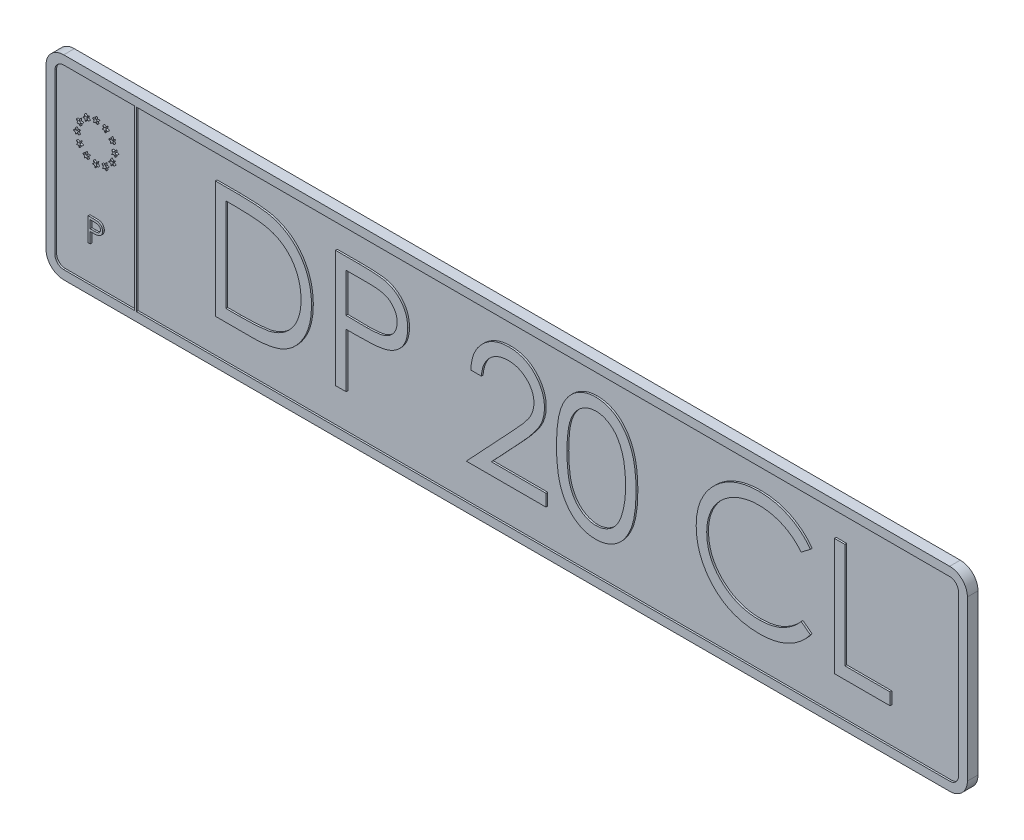
from build123d import *

# Parameters (mm, degrees)
BOSS_EXTRUDE1_DEPTH  = 5
BOSS_EXTRUDE2_DEPTH  = 1
SKETCH3_W            = 1
SKETCH3_H            = 100
BOSS_EXTRUDE4_DEPTH  = 1
BOSS_EXTRUDE9_DEPTH  = 1
BOSS_EXTRUDE8_DEPTH  = 1
BOSS_EXTRUDE10_DEPTH = 1


with BuildPart() as part:
    # Sketch1 → Boss-Extrude1 (new body)
    with BuildSketch(Plane.XY):
        with BuildLine():
            Line((10, 0), (510, 0))
            ThreePointArc((510, 0), (517.071067812, -2.928932188), (520, -10))
            Line((520, -10), (520, -100))
            ThreePointArc((520, -100), (517.071067812, -107.071067812), (510, -110))
            Line((510, -110), (10, -110))
            ThreePointArc((10, -110), (2.928932188, -107.071067812), (0, -100))
            Line((0, -100), (0, -10))
            ThreePointArc((0, -10), (2.928932188, -2.928932188), (10, 0))
        make_face()
    extrude(amount=BOSS_EXTRUDE1_DEPTH)

    # Sketch2 → Boss-Extrude2 (add)
    with BuildSketch(Plane.XY.offset(5)):
        with BuildLine():
            Line((510, 0), (10, 0))
            ThreePointArc((10, 0), (2.928932188, -2.928932188), (0, -10))
            Line((0, -10), (0, -100))
            ThreePointArc((0, -100), (2.928932188, -107.071067812), (10, -110))
            Line((10, -110), (510, -110))
            ThreePointArc((510, -110), (517.071067812, -107.071067812), (520, -100))
            Line((520, -100), (520, -10))
            ThreePointArc((520, -10), (517.071067812, -2.928932188), (510, 0))
        make_face()
        with BuildLine():
            Line((510, -5), (10, -5))
            ThreePointArc((10, -5), (6.464466094, -6.464466094), (5, -10))
            Line((5, -10), (5, -100))
            ThreePointArc((5, -100), (6.464466094, -103.535533906), (10, -105))
            Line((10, -105), (510, -105))
            ThreePointArc((510, -105), (513.535533906, -103.535533906), (515, -100))
            Line((515, -100), (515, -10))
            ThreePointArc((515, -10), (513.535533906, -6.464466094), (510, -5))
        make_face(mode=Mode.SUBTRACT)
    extrude(amount=BOSS_EXTRUDE2_DEPTH)

    # Sketch3 → Boss-Extrude4 (add)
    with BuildSketch(Plane.XY.offset(5)):
        with Locations((50.5, -55)):
            Rectangle(SKETCH3_W, SKETCH3_H)
    extrude(amount=BOSS_EXTRUDE4_DEPTH)

    # Sketch10 → Boss-Extrude9 (add)
    with BuildSketch(Plane.XY.offset(5)):
        with BuildLine():
            Line((23.768696581, -71.770833333), (26.36311849, -71.770833333))
            add(Edge.make_bspline(
                [(26.36311849, -71.770833333), (26.541564474, -71.771029489), (26.883474905, -71.771405331), (27.373766931, -71.782800353), (27.819059667, -71.79802029), (28.218392952, -71.819118517), (28.572995466, -71.844052058), (28.881262639, -71.879022564), (29.14561751, -71.915536181), (29.304013911, -71.952658759), (29.376252003, -71.969588842)],
                knots=[0, 0, 0, 0, 1.415646017, 2.712440637, 3.8905458, 4.950247383, 5.884950622, 6.709939814, 7.411656543, 8, 8, 8, 8], degree=3))
            add(Edge.make_bspline(
                [(29.376252003, -71.969588842), (29.467697801, -71.994618236), (29.648434589, -72.044087237), (29.908864127, -72.14316887), (30.156642055, -72.260652054), (30.392618481, -72.394546113), (30.613893617, -72.550595715), (30.823768831, -72.722475163), (31.020391971, -72.914152818), (31.202657351, -73.123478829), (31.370043342, -73.346939146), (31.514164464, -73.587869598), (31.634841781, -73.842214704), (31.738344027, -74.109797547), (31.812837292, -74.392865139), (31.868955038, -74.689450629), (31.904574107, -74.999522226), (31.907985576, -75.211415178), (31.909722222, -75.319281684)],
                knots=[0, 0, 0, 0, 0.999701418, 1.975846123, 2.934577507, 3.890451536, 4.834027766, 5.787354733, 6.749476667, 7.726910423, 8.712836071, 9.690891519, 10.682875813, 11.679750201, 12.712814741, 13.765529915, 14.8625177, 16, 16, 16, 16], degree=3))
            add(Edge.make_bspline(
                [(31.909722222, -75.319281684), (31.908129337, -75.428054828), (31.90501275, -75.640876832), (31.867607147, -75.952226359), (31.817222197, -76.249763131), (31.739748219, -76.532827423), (31.638277967, -76.799738222), (31.519245505, -77.054574426), (31.375676804, -77.293000567), (31.21070974, -77.515882232), (31.027196273, -77.723428627), (30.825912846, -77.914135737), (30.607672067, -78.086887254), (30.37316752, -78.242070458), (30.120113032, -78.376086752), (29.852346558, -78.496121804), (29.567540681, -78.596932063), (29.370454393, -78.649962354), (29.270249065, -78.676924746)],
                knots=[0, 0, 0, 0, 1.121902311, 2.195077645, 3.232258892, 4.234102512, 5.217864754, 6.176164875, 7.132989551, 8.084763148, 9.034132444, 9.988522005, 10.94243251, 11.903244335, 12.886203696, 13.894208494, 14.929344452, 16, 16, 16, 16], degree=3))
            add(Edge.make_bspline(
                [(29.270249065, -78.676924746), (29.187368963, -78.694549705), (29.005732402, -78.733175825), (28.706591755, -78.776297076), (28.358304136, -78.813102888), (27.961344923, -78.84069945), (27.516070431, -78.864324354), (27.022239786, -78.883102566), (26.478883602, -78.893420764), (26.099882173, -78.893952927), (25.902005709, -78.894230769)],
                knots=[0, 0, 0, 0, 0.601384939, 1.31797006, 2.144135048, 3.087295005, 4.142315834, 5.309527816, 6.595305764, 8, 8, 8, 8], degree=3))
            Line((25.902005709, -78.894230769), (24.955929487, -78.894230769))
            Line((24.955929487, -78.894230769), (24.955929487, -85))
            Line((24.955929487, -85), (23.768696581, -85))
            Line((23.768696581, -85), (23.768696581, -71.770833333))
        make_face()
        with BuildLine():
            Line((24.955929487, -73.12767094), (24.955929487, -77.537393162))
            Line((24.955929487, -77.537393162), (27.272093683, -77.56654397))
            add(Edge.make_bspline(
                [(27.272093683, -77.56654397), (27.385183879, -77.566602419), (27.60350217, -77.566715253), (27.918871228, -77.551652057), (28.211459904, -77.534263139), (28.480369459, -77.508802952), (28.725721117, -77.472814866), (28.947923979, -77.436484785), (29.145255078, -77.383925825), (29.376195513, -77.313157082), (29.633534356, -77.192459398), (29.913492054, -77.017267849), (30.150749925, -76.793956839), (30.356060154, -76.542875452), (30.51899011, -76.263554338), (30.638264247, -75.964692583), (30.708345407, -75.649355176), (30.717742628, -75.433575603), (30.722489316, -75.324581831)],
                knots=[0, 0, 0, 0, 1.160613943, 2.240541288, 3.23993089, 4.169200891, 5.011653406, 5.7853311, 6.478053781, 7.106038997, 8.262395093, 9.384106736, 10.481365981, 11.59014053, 12.70357646, 13.786202915, 14.881775077, 16, 16, 16, 16], degree=3))
            add(Edge.make_bspline(
                [(30.722489316, -75.324581831), (30.717716813, -75.21822495), (30.708229668, -75.006800633), (30.637714947, -74.696940437), (30.519222004, -74.401228102), (30.354966424, -74.125407214), (30.15561751, -73.875229294), (29.923920588, -73.657903844), (29.660421059, -73.483196812), (29.415310186, -73.370434111), (29.197591417, -73.301584707), (29.008482521, -73.253412244), (28.794961222, -73.214950875), (28.556958007, -73.183807517), (28.296317594, -73.157147113), (28.010800749, -73.139057258), (27.701489061, -73.128468421), (27.48675863, -73.127943203), (27.375446548, -73.12767094)],
                knots=[0, 0, 0, 0, 1.120700087, 2.227813068, 3.331159281, 4.466773991, 5.599788987, 6.693661531, 7.80175334, 8.91857717, 9.525282508, 10.207424825, 10.974604443, 11.810962634, 12.737642355, 13.736264703, 14.826523623, 16, 16, 16, 16], degree=3))
            Line((27.375446548, -73.12767094), (24.955929487, -73.12767094))
        make_face(mode=Mode.SUBTRACT)
    extrude(amount=BOSS_EXTRUDE9_DEPTH)

    # Sketch9 → Boss-Extrude8 (add)
    # profile 1 of 6: a face of its own
    with BuildSketch(Plane.XY.offset(5)):
        with BuildLine():
            Line((95.586805556, -85), (95.586805556, -18.854166667))
            Line((95.586805556, -18.854166667), (108.943175748, -18.854166667))
            add(Edge.make_bspline(
                [(108.943175748, -18.854166667), (110.104866448, -18.862530713), (112.349246834, -18.878690006), (115.59251779, -18.981147845), (118.593341872, -19.162396232), (121.341849775, -19.426403646), (123.845586966, -19.750575561), (126.097542803, -20.156907607), (128.109361575, -20.636713803), (129.346656063, -21.045787045), (129.931757479, -21.239232772)],
                knots=[0, 0, 0, 0, 1.314313732, 2.53924729, 3.670748893, 4.714932338, 5.66265055, 6.526160246, 7.303039223, 8, 8, 8, 8], degree=3))
            add(Edge.make_bspline(
                [(129.931757479, -21.239232772), (130.697059844, -21.530854739), (132.210310055, -22.107485654), (134.364908949, -23.19523123), (136.39323054, -24.427681218), (138.306151879, -25.806460171), (140.059977021, -27.370607828), (141.723221498, -29.053680726), (143.227844999, -30.916882989), (144.605724998, -32.921573982), (145.848050705, -35.044138065), (146.927912766, -37.280530744), (147.824736747, -39.619394646), (148.569221833, -42.054225568), (149.15596292, -44.590377351), (149.556276213, -47.230803093), (149.820311289, -49.965067536), (149.846846188, -51.820448026), (149.860309829, -52.76185647)],
                knots=[0, 0, 0, 0, 0.984719456, 1.947108742, 2.898477687, 3.838006223, 4.779231079, 5.722358779, 6.681677486, 7.655904652, 8.64651281, 9.637519902, 10.640069247, 11.656948941, 12.698408672, 13.768548281, 14.867775369, 16, 16, 16, 16], degree=3))
            add(Edge.make_bspline(
                [(149.860309829, -52.76185647), (149.848423092, -53.579442376), (149.824999037, -55.190580798), (149.614668216, -57.565044153), (149.308955024, -59.869065516), (148.8356495, -62.09167324), (148.261078189, -64.252340453), (147.524702116, -66.328039119), (146.681144376, -68.337810515), (145.697463635, -70.254480075), (144.617559484, -72.070341427), (143.458651539, -73.78211108), (142.221975897, -75.36536304), (140.895739978, -76.824891869), (139.497082241, -78.158497294), (138.016845637, -79.377319608), (136.4512106, -80.457510451), (134.8071895, -81.441516812), (133.036822177, -82.299907459), (131.106575897, -83.026188894), (129.008218813, -83.628052012), (126.746901472, -84.130210311), (124.318716699, -84.528546239), (121.721283863, -84.795518239), (118.958593716, -84.976057294), (117.061545102, -84.991864133), (116.085123698, -85)],
                knots=[0, 0, 0, 0, 1.105936401, 2.179363191, 3.223086493, 4.248585256, 5.251745608, 6.245858792, 7.225916811, 8.198733463, 9.158002045, 10.082870192, 10.993790845, 11.873723703, 12.748670949, 13.606408763, 14.465103618, 15.319838547, 16.196477973, 17.123216899, 18.106603292, 19.147568657, 20.255746949, 21.433717677, 22.679120308, 24, 24, 24, 24], degree=3))
            Line((116.085123698, -85), (95.586805556, -85))
        make_face()
        with BuildLine():
            Line((101.522970085, -78.215811966), (109.115430522, -78.215811966))
            add(Edge.make_bspline(
                [(109.115430522, -78.215811966), (110.206428005, -78.21112324), (112.304815713, -78.202105102), (115.322161793, -78.122971948), (118.07910872, -77.993667474), (120.57604796, -77.812709902), (122.811569699, -77.573288157), (124.790345925, -77.306344311), (126.505890241, -76.973773441), (127.543991207, -76.672319297), (128.023704594, -76.533015325)],
                knots=[0, 0, 0, 0, 1.375205317, 2.645023457, 3.804390687, 4.853969522, 5.800190428, 6.637939096, 7.370582563, 8, 8, 8, 8], degree=3))
            add(Edge.make_bspline(
                [(128.023704594, -76.533015325), (128.627490604, -76.320374268), (129.820641206, -75.900171084), (131.538185525, -75.13367957), (133.139992012, -74.225741645), (134.65397612, -73.216502241), (136.058661424, -72.070365), (137.370694574, -70.812252563), (138.587433975, -69.435762022), (139.696308546, -67.942601826), (140.688652982, -66.342065509), (141.548005085, -64.649888147), (142.30115159, -62.884610632), (142.892279754, -61.019125045), (143.35559511, -59.070108613), (143.68376704, -57.037424226), (143.888152458, -54.921451488), (143.911992322, -53.482266997), (143.924145299, -52.748606103)],
                knots=[0, 0, 0, 0, 0.998632004, 1.973411704, 2.929992603, 3.868527914, 4.809262121, 5.754881198, 6.702106254, 7.672490631, 8.653608572, 9.636854334, 10.631411391, 11.644891563, 12.686317036, 13.754757253, 14.855430412, 16, 16, 16, 16], degree=3))
            add(Edge.make_bspline(
                [(143.924145299, -52.748606103), (143.914444779, -51.975012056), (143.895388021, -50.455279702), (143.655858643, -48.225396027), (143.305823293, -46.080746828), (142.799643513, -44.021188671), (142.154610534, -42.042703444), (141.349622513, -40.156233534), (140.429881345, -38.341855804), (139.335577212, -36.641447404), (138.137097992, -35.033288942), (136.807039856, -33.560033841), (135.366534068, -32.218326083), (133.831292121, -30.987270621), (132.158046347, -29.916394603), (130.386213203, -28.958476672), (128.489799476, -28.145527535), (127.170422635, -27.713144266), (126.49991236, -27.493406116)],
                knots=[0, 0, 0, 0, 1.122418816, 2.205001699, 3.251619955, 4.274784885, 5.280384055, 6.268708349, 7.249350384, 8.229342522, 9.199999885, 10.157847722, 11.105861043, 12.055065948, 13.010012805, 13.98527497, 14.976112212, 16, 16, 16, 16], degree=3))
            add(Edge.make_bspline(
                [(126.49991236, -27.493406116), (125.945210635, -27.340015292), (124.765762575, -27.013864314), (122.841117942, -26.658087184), (120.675028065, -26.34428192), (118.257875975, -26.078601712), (115.592417001, -25.887963347), (112.676601172, -25.744874515), (109.509168169, -25.64836524), (107.313456591, -25.641775089), (106.173848992, -25.638354701)],
                knots=[0, 0, 0, 0, 0.674548936, 1.434276114, 2.292660221, 3.240891867, 4.284742987, 5.42552168, 6.663806718, 8, 8, 8, 8], degree=3))
            Line((106.173848992, -25.638354701), (101.522970085, -25.638354701))
            Line((101.522970085, -25.638354701), (101.522970085, -78.215811966))
        make_face(mode=Mode.SUBTRACT)
    # profile 2 of 6: a face of its own
    with BuildSketch(Plane.XY.offset(5)):
        with BuildLine():
            Line((163.428685897, -18.854166667), (176.400795439, -18.854166667))
            add(Edge.make_bspline(
                [(176.400795439, -18.854166667), (177.293025362, -18.855147444), (179.002577518, -18.857026656), (181.454037648, -18.914001764), (183.680501326, -18.99010145), (185.677167751, -19.095592587), (187.45018032, -19.220260289), (188.991516189, -19.395112819), (190.313290542, -19.577680905), (191.105272548, -19.763293796), (191.466463007, -19.847944211)],
                knots=[0, 0, 0, 0, 1.415646017, 2.712440637, 3.8905458, 4.950247383, 5.884950622, 6.709939814, 7.411656543, 8, 8, 8, 8], degree=3))
            add(Edge.make_bspline(
                [(191.466463007, -19.847944211), (191.923691994, -19.973091179), (192.827375939, -20.220436185), (194.129523628, -20.715844351), (195.368413267, -21.303260271), (196.548295399, -21.972730563), (197.654671076, -22.752978576), (198.704047148, -23.612375816), (199.687162847, -24.570764091), (200.598489747, -25.617394145), (201.435419701, -26.734695731), (202.156025312, -27.939347992), (202.759411895, -29.211073518), (203.276923127, -30.548987735), (203.649389454, -31.964325694), (203.929978183, -33.447253145), (204.108073526, -34.997611129), (204.125130869, -36.057075888), (204.133814103, -36.59640842)],
                knots=[0, 0, 0, 0, 0.999701418, 1.975846123, 2.934577507, 3.890451536, 4.834027766, 5.787354733, 6.749476667, 7.726910423, 8.712836071, 9.690891519, 10.682875813, 11.679750201, 12.712814741, 13.765529915, 14.8625177, 16, 16, 16, 16], degree=3))
            add(Edge.make_bspline(
                [(204.133814103, -36.59640842), (204.125849677, -37.140274142), (204.11026674, -38.20438416), (203.923238729, -39.761131794), (203.671313976, -41.248815655), (203.283944089, -42.664137115), (202.776592826, -43.99869111), (202.181430518, -45.272872132), (201.463587012, -46.465002836), (200.638751689, -47.579411159), (199.721184355, -48.617143133), (198.71476722, -49.570678683), (197.623563329, -50.43443627), (196.45104059, -51.210352289), (195.185768149, -51.880433761), (193.846935783, -52.480609018), (192.422906395, -52.984660313), (191.437474955, -53.249811771), (190.936448317, -53.384623731)],
                knots=[0, 0, 0, 0, 1.121902311, 2.195077645, 3.232258892, 4.234102512, 5.217864754, 6.176164875, 7.132989551, 8.084763148, 9.034132444, 9.988522005, 10.94243251, 11.903244335, 12.886203696, 13.894208494, 14.929344452, 16, 16, 16, 16], degree=3))
            add(Edge.make_bspline(
                [(190.936448317, -53.384623731), (190.522047809, -53.472748523), (189.613865, -53.665879126), (188.118161768, -53.881485379), (186.376723671, -54.06551444), (184.391927607, -54.203497248), (182.165555148, -54.321621771), (179.696401922, -54.415512831), (176.979620999, -54.467103819), (175.084613857, -54.469764635), (174.095231537, -54.471153846)],
                knots=[0, 0, 0, 0, 0.601384939, 1.31797006, 2.144135048, 3.087295005, 4.142315834, 5.309527816, 6.595305764, 8, 8, 8, 8], degree=3))
            Line((174.095231537, -54.471153846), (169.364850427, -54.471153846))
            Line((169.364850427, -54.471153846), (169.364850427, -85))
            Line((169.364850427, -85), (163.428685897, -85))
            Line((163.428685897, -85), (163.428685897, -18.854166667))
        make_face()
        with BuildLine():
            Line((169.364850427, -25.638354701), (169.364850427, -47.686965812))
            Line((169.364850427, -47.686965812), (180.945671408, -47.832719852))
            add(Edge.make_bspline(
                [(180.945671408, -47.832719852), (181.511122386, -47.833012095), (182.602713844, -47.833576265), (184.179559134, -47.758260286), (185.64250251, -47.671315695), (186.987050289, -47.544014761), (188.213808574, -47.364074329), (189.324822885, -47.182423925), (190.31147838, -46.919629126), (191.466180556, -46.565785409), (192.752874772, -45.962296988), (194.152663263, -45.086339244), (195.338952618, -43.969784193), (196.365503763, -42.714377262), (197.180153539, -41.317771691), (197.776524227, -39.823462916), (198.126930029, -38.246775879), (198.173916129, -37.167878017), (198.197649573, -36.622909155)],
                knots=[0, 0, 0, 0, 1.160613943, 2.240541288, 3.23993089, 4.169200891, 5.011653406, 5.7853311, 6.478053781, 7.106038997, 8.262395093, 9.384106736, 10.481365981, 11.59014053, 12.70357646, 13.786202915, 14.881775077, 16, 16, 16, 16], degree=3))
            add(Edge.make_bspline(
                [(198.197649573, -36.622909155), (198.173787057, -36.091124749), (198.126351329, -35.034003166), (197.773777725, -33.484702185), (197.181313014, -32.006140509), (196.360035111, -30.627036069), (195.363290542, -29.37614647), (194.204805933, -28.289519218), (192.887308286, -27.415984062), (191.661753919, -26.852170554), (190.573160076, -26.507923534), (189.627615596, -26.267061221), (188.560009099, -26.074754377), (187.369993028, -25.919037583), (186.066790959, -25.785735563), (184.639206734, -25.695286291), (183.092648298, -25.642342103), (182.01899614, -25.639716014), (181.462435731, -25.638354701)],
                knots=[0, 0, 0, 0, 1.120700087, 2.227813068, 3.331159281, 4.466773991, 5.599788987, 6.693661531, 7.80175334, 8.91857717, 9.525282508, 10.207424825, 10.974604443, 11.810962634, 12.737642355, 13.736264703, 14.826523623, 16, 16, 16, 16], degree=3))
            Line((181.462435731, -25.638354701), (169.364850427, -25.638354701))
        make_face(mode=Mode.SUBTRACT)
    # profile 3 of 6: a face of its own
    with BuildSketch(Plane.XY.offset(5)):
        with BuildLine():
            Line((245.686965812, -39.206730769), (239.750801282, -39.206730769))
            add(Edge.make_bspline(
                [(239.750801282, -39.206730769), (239.789490037, -38.419200599), (239.865473722, -36.872512302), (240.221305974, -34.617432524), (240.730456481, -32.461932607), (241.450339615, -30.42331965), (242.344371947, -28.483568382), (243.416501929, -26.650383562), (244.686385711, -24.930758418), (246.126602262, -23.340634445), (247.690831006, -21.881881247), (249.378606946, -20.622176509), (251.152166241, -19.557839565), (253.006128097, -18.668060144), (254.961409581, -18.000179127), (257.000267162, -17.504621355), (259.131658579, -17.206467202), (260.58384352, -17.174418873), (261.322399172, -17.158119658)],
                knots=[0, 0, 0, 0, 1.10065271, 2.161652631, 3.183658789, 4.190468796, 5.17591951, 6.163126047, 7.15150782, 8.156236427, 9.156009102, 10.134482811, 11.092018607, 12.041330605, 13.001268258, 13.972401359, 14.968799086, 16, 16, 16, 16], degree=3))
            add(Edge.make_bspline(
                [(261.322399172, -17.158119658), (262.047699084, -17.175099415), (263.472887502, -17.208464032), (265.552928549, -17.494989436), (267.53309468, -17.943752849), (269.409515267, -18.573374557), (271.167219166, -19.419746919), (272.819410633, -20.436456355), (274.38575929, -21.612337097), (275.795738682, -22.996746964), (277.090459823, -24.474678933), (278.207422085, -26.052500921), (279.163950621, -27.682131767), (279.961247547, -29.375998076), (280.548171602, -31.150048762), (280.993771664, -32.97845572), (281.245643917, -34.880144856), (281.284299986, -36.167277679), (281.303952991, -36.821664663)],
                knots=[0, 0, 0, 0, 1.111607364, 2.184268762, 3.212621178, 4.221274766, 5.211760367, 6.196651075, 7.1921475, 8.207485113, 9.220403448, 10.201281604, 11.166441695, 12.114753415, 13.065576456, 14.026450734, 14.996634279, 16, 16, 16, 16], degree=3))
            add(Edge.make_bspline(
                [(281.303952991, -36.821664663), (281.271952339, -37.742940704), (281.208512601, -39.569325694), (280.665845068, -42.253237535), (279.818299397, -44.853589354), (278.797813635, -46.946392533), (277.76834929, -48.632799335), (276.840653834, -50.021270395), (275.754637316, -51.516269575), (274.494493084, -53.112790683), (273.086288506, -54.823339038), (271.517268455, -56.646881302), (269.776244315, -58.564576952), (268.554275625, -59.874370312), (267.921082065, -60.553072416)],
                knots=[0, 0, 0, 0, 1.184426356, 2.348067706, 3.509069118, 4.696110526, 5.333549288, 6.050745305, 6.844228056, 7.710549037, 8.667450064, 9.695053472, 10.805634456, 12, 12, 12, 12], degree=3))
            Line((267.921082065, -60.553072416), (251.371373364, -78.215811966))
            Line((251.371373364, -78.215811966), (282.151976496, -78.215811966))
            Line((282.151976496, -78.215811966), (282.151976496, -85))
            Line((282.151976496, -85), (237.206730769, -85))
            Line((237.206730769, -85), (262.859441774, -57.624741253))
            add(Edge.make_bspline(
                [(262.859441774, -57.624741253), (263.484007491, -56.972764328), (264.683670415, -55.720450087), (266.380454232, -53.892123311), (267.904435113, -52.195963836), (269.265478101, -50.635176387), (270.434057741, -49.186930984), (271.471077601, -47.89813227), (272.30197493, -46.712147867), (273.203739105, -45.33743686), (274.077128337, -43.658989795), (274.827644589, -41.607832274), (275.285276398, -39.496320207), (275.340174331, -38.069421591), (275.367788462, -37.351679354)],
                knots=[0, 0, 0, 0, 1.329631726, 2.553950428, 3.673215718, 4.687767853, 5.603093632, 6.413772471, 7.123043292, 7.734684054, 8.834405432, 9.900288307, 10.943827018, 12, 12, 12, 12], degree=3))
            add(Edge.make_bspline(
                [(275.367788462, -37.351679354), (275.355773689, -36.900349354), (275.332094879, -36.010864593), (275.123117561, -34.706737897), (274.807308889, -33.44874216), (274.354772018, -32.23300784), (273.757442257, -31.071758165), (273.030341179, -29.963579596), (272.191421825, -28.892225641), (271.220943967, -27.887691585), (270.1548334, -26.967674755), (269.028573028, -26.152680879), (267.837001117, -25.471584589), (266.585141665, -24.913247663), (265.276484729, -24.475260548), (263.908499218, -24.171772514), (262.484964982, -23.981225571), (261.512933144, -23.955444346), (261.017640725, -23.942307692)],
                knots=[0, 0, 0, 0, 0.991446411, 1.95395049, 2.89581595, 3.838931463, 4.798493298, 5.75982156, 6.748411868, 7.785213223, 8.824556874, 9.840280684, 10.836137867, 11.835679398, 12.848801643, 13.863922112, 14.911575587, 16, 16, 16, 16], degree=3))
            add(Edge.make_bspline(
                [(261.017640725, -23.942307692), (260.50036457, -23.955820951), (259.484519612, -23.982358759), (257.993043841, -24.167995415), (256.570232272, -24.488251625), (255.212505832, -24.92626318), (253.917567231, -25.482994683), (252.691714018, -26.176424977), (251.537698105, -27.003880874), (250.453350119, -27.942028293), (249.454283848, -28.986520161), (248.576493188, -30.150875118), (247.809503635, -31.413833712), (247.140311276, -32.771988164), (246.596862966, -34.23766228), (246.181596582, -35.805653131), (245.853005877, -37.469152453), (245.743231753, -38.617918193), (245.686965812, -39.206730769)],
                knots=[0, 0, 0, 0, 1.031018746, 2.02475058, 2.990194455, 3.934040569, 4.864654155, 5.795059489, 6.735614925, 7.690564532, 8.649604399, 9.611025574, 10.590972636, 11.591080095, 12.624614302, 13.701020113, 14.821632451, 16, 16, 16, 16], degree=3))
        make_face()
    # profile 4 of 6: a face of its own
    with BuildSketch(Plane.XY.offset(5)):
        with BuildLine():
            add(Edge.make_bspline(
                [(288.088141026, -51.953584068), (288.094340178, -50.893410222), (288.106382122, -48.834007246), (288.240344839, -45.83316654), (288.46288479, -43.017994412), (288.767861926, -40.38835611), (289.138996374, -37.943572763), (289.634437862, -35.690177799), (290.19786434, -33.617741782), (290.850864432, -31.719506639), (291.58768723, -29.969898264), (292.389644241, -28.336564846), (293.288562231, -26.821977732), (294.233066389, -25.401962943), (295.261389766, -24.09976514), (296.344268693, -22.896994583), (297.523967843, -21.82144915), (298.760384815, -20.841615757), (300.064713829, -19.982674849), (301.399776121, -19.226103747), (302.774761008, -18.57976697), (304.1934225, -18.071569745), (305.643009532, -17.651811182), (307.128589513, -17.364758154), (308.652615289, -17.184143961), (309.681304608, -17.166876728), (310.203003973, -17.158119658)],
                knots=[0, 0, 0, 0, 1.646270934, 3.197905019, 4.663502075, 6.030701355, 7.308322542, 8.50163776, 9.611534131, 10.641858119, 11.616356847, 12.558055219, 13.465016945, 14.349605745, 15.204443733, 16.039544428, 16.859896111, 17.680448484, 18.487036065, 19.28249412, 20.06191084, 20.843045899, 21.620316918, 22.403196591, 23.190181807, 24, 24, 24, 24], degree=3))
            add(Edge.make_bspline(
                [(310.203003973, -17.158119658), (310.729061379, -17.167338784), (311.775224047, -17.185672725), (313.32190971, -17.361884139), (314.832863516, -17.654269948), (316.301643816, -18.068550271), (317.740315436, -18.582516184), (319.13762552, -19.226722118), (320.502253403, -19.976605474), (321.812513301, -20.85774125), (323.082789513, -21.840144387), (324.28188048, -22.950688871), (325.409895348, -24.178161245), (326.480991149, -25.509428613), (327.464779965, -26.97002471), (328.401658818, -28.534545833), (329.240237473, -30.230352355), (330.047871959, -32.029149887), (330.744992096, -33.980710106), (331.373684529, -36.074032217), (331.881665036, -38.333841998), (332.304795629, -40.748282943), (332.632593514, -43.326221987), (332.87133541, -46.062133009), (332.997448773, -48.957815987), (333.02119893, -50.937614625), (333.033386752, -51.953584068)],
                knots=[0, 0, 0, 0, 0.810914788, 1.612654377, 2.396697861, 3.181598691, 3.963628158, 4.749916497, 5.551656086, 6.361998678, 7.18212741, 8.025565596, 8.878627764, 9.750805457, 10.657531673, 11.591944965, 12.560506719, 13.57287815, 14.630710178, 15.753379473, 16.941251878, 18.199788006, 19.531962791, 20.947069417, 22.433333509, 24, 24, 24, 24], degree=3))
            add(Edge.make_bspline(
                [(333.033386752, -51.953584068), (333.02107258, -52.965122209), (332.997078918, -54.936063025), (332.872749192, -57.818716874), (332.627846489, -60.540108467), (332.321497008, -63.106764528), (331.897200535, -65.508002265), (331.375495756, -67.752130978), (330.796241143, -69.848841857), (330.081208576, -71.780958088), (329.298595449, -73.575432612), (328.447105878, -75.25113616), (327.534863629, -76.822880084), (326.540998954, -78.278083634), (325.481656175, -79.627055278), (324.33416225, -80.845983564), (323.13086399, -81.964238822), (321.856849584, -82.959291901), (320.526155089, -83.830239846), (319.1662142, -84.609132554), (317.752897283, -85.237190928), (316.318232849, -85.776469232), (314.841699739, -86.18847182), (313.325138487, -86.473349744), (311.776263195, -86.673145094), (310.729239569, -86.688386604), (310.203003973, -86.696047009)],
                knots=[0, 0, 0, 0, 1.561518951, 3.042555995, 4.452378317, 5.7783523, 7.031515105, 8.214008947, 9.334062868, 10.386615937, 11.391082383, 12.354592575, 13.286541444, 14.194233754, 15.072674879, 15.931287219, 16.775624067, 17.606195743, 18.42308326, 19.229000347, 20.022332153, 20.807536673, 21.593273796, 22.3848459, 23.188221202, 24, 24, 24, 24], degree=3))
            add(Edge.make_bspline(
                [(310.203003973, -86.696047009), (309.681319081, -86.687233446), (308.6526583, -86.66985482), (307.128423474, -86.49005662), (305.648978487, -86.200989819), (304.207022867, -85.796241497), (302.795158668, -85.300812299), (301.432624679, -84.655348338), (300.104271134, -83.911981261), (298.813642024, -83.065401124), (297.584989576, -82.09548241), (296.411399863, -81.02270493), (295.322355603, -79.820298199), (294.308735046, -78.507248164), (293.345385462, -77.095634804), (292.459232127, -75.566184897), (291.639574617, -73.924962943), (290.890359838, -72.161365524), (290.226091942, -70.24965781), (289.63932722, -68.167969466), (289.176038827, -65.897926938), (288.779485951, -63.457762411), (288.45963526, -60.836990215), (288.241272266, -58.034187562), (288.106309914, -55.051101024), (288.094307839, -53.004931182), (288.088141026, -51.953584068)],
                knots=[0, 0, 0, 0, 0.810891512, 1.598919785, 2.382837074, 3.152667961, 3.926044502, 4.706494248, 5.493654104, 6.291793342, 7.103789334, 7.925228297, 8.761435821, 9.622817696, 10.50288917, 11.416980706, 12.369136599, 13.353924996, 14.394355917, 15.514179734, 16.714354668, 17.994756427, 19.357759367, 20.818452758, 22.365282078, 24, 24, 24, 24], degree=3))
        make_face()
        with BuildLine():
            add(Edge.make_bspline(
                [(294.024305556, -51.927083333), (294.026562963, -52.810578088), (294.030944147, -54.525267922), (294.145399129, -57.016948598), (294.301318692, -59.34094142), (294.50242654, -61.500197243), (294.801083454, -63.487407301), (295.135720665, -65.316239109), (295.542953906, -66.977014274), (296.024779392, -68.481129149), (296.573583753, -69.854110057), (297.172786832, -71.131692545), (297.816493946, -72.328968725), (298.536900512, -73.43518424), (299.321485784, -74.453946567), (300.152528032, -75.403287297), (301.061042645, -76.249896915), (302.317884208, -77.265270514), (303.977133055, -78.314516047), (306.067727968, -79.22819959), (308.215926372, -79.802391847), (309.673993152, -79.875412235), (310.401759482, -79.911858974)],
                knots=[0, 0, 0, 0, 1.459021318, 2.831673884, 4.118529203, 5.306027144, 6.411944654, 7.436330062, 8.375795394, 9.233974572, 10.042671642, 10.816086306, 11.563610507, 12.285937304, 12.993564865, 13.685989202, 14.367179055, 15.041617293, 16.353048772, 17.594441528, 18.799311195, 20, 20, 20, 20], degree=3))
            add(Edge.make_bspline(
                [(310.401759482, -79.911858974), (311.134233336, -79.881662819), (312.597668759, -79.821332852), (314.735762804, -79.239273381), (316.811424159, -78.361054406), (318.438081363, -77.322611968), (319.67562348, -76.333668837), (320.56229874, -75.490505096), (321.376120191, -74.546398675), (322.147986784, -73.527766148), (322.85591872, -72.415146284), (323.499671471, -71.213889281), (324.087109736, -69.920659282), (324.421789622, -69.017868081), (324.592902811, -68.556294237)],
                knots=[0, 0, 0, 0, 1.353760809, 2.704726607, 4.075137775, 5.516104923, 6.260822281, 7.007110065, 7.778089737, 8.566572457, 9.372053459, 10.217411131, 11.088608312, 12, 12, 12, 12], degree=3))
            add(Edge.make_bspline(
                [(324.592902811, -68.556294237), (324.792318661, -67.96608934), (325.197218357, -66.767720283), (325.719048019, -64.908764359), (326.130010177, -62.958354981), (326.4997345, -60.928148162), (326.75209136, -58.803171669), (326.955212236, -56.590000426), (327.074854682, -54.286965753), (327.089685543, -52.722238984), (327.097222222, -51.927083333)],
                knots=[0, 0, 0, 0, 0.884706709, 1.796334032, 2.740027952, 3.714592787, 4.726048262, 5.777819803, 6.87074269, 8, 8, 8, 8], degree=3))
            add(Edge.make_bspline(
                [(327.097222222, -51.927083333), (327.086824301, -51.132056293), (327.066483743, -49.576813447), (326.988734273, -47.299163306), (326.787961363, -45.135858896), (326.564972063, -43.077580618), (326.236185295, -41.135722219), (325.881685076, -39.294027462), (325.405412165, -37.575312558), (324.896660465, -35.952668678), (324.314380669, -34.444531308), (323.673413667, -33.043868977), (322.988865548, -31.743919566), (322.245344039, -30.548249688), (321.451675624, -29.451503713), (320.586912417, -28.475671346), (319.685356562, -27.590508407), (318.422591294, -26.580129496), (316.769431353, -25.549923346), (314.712378196, -24.601850206), (312.571697866, -24.057407771), (311.124550743, -23.980646722), (310.401759482, -23.942307692)],
                knots=[0, 0, 0, 0, 1.31362396, 2.569729283, 3.763502607, 4.902122613, 5.988968491, 7.01645872, 7.998833611, 8.933434873, 9.825090667, 10.667526885, 11.477055099, 12.250526234, 12.991942729, 13.710640831, 14.402115721, 15.076753259, 16.378508321, 17.609869233, 18.806226677, 20, 20, 20, 20], degree=3))
            add(Edge.make_bspline(
                [(310.401759482, -23.942307692), (309.670175375, -23.980699616), (308.205674392, -24.057553403), (306.042744295, -24.599821737), (303.969462649, -25.545007254), (302.320674288, -26.583541674), (301.057028323, -27.572673453), (300.167221469, -28.430423403), (299.332911369, -29.368678508), (298.564340251, -30.396809935), (297.844498143, -31.501735775), (297.183398649, -32.692148442), (296.587758639, -33.974080474), (296.038095529, -35.346444655), (295.554800279, -36.850429766), (295.156149486, -38.509159258), (294.787867381, -40.332174177), (294.527153222, -42.330147021), (294.295382838, -44.489943669), (294.146434744, -46.819738225), (294.030561277, -49.315597795), (294.026432561, -51.039153321), (294.024305556, -51.927083333)],
                knots=[0, 0, 0, 0, 1.207732386, 2.417664972, 3.655092373, 4.956220595, 5.625982001, 6.301752483, 6.994047911, 7.697131622, 8.419323945, 9.170223765, 9.943494443, 10.752040957, 11.610060368, 12.549350801, 13.567764191, 14.679664412, 15.874934091, 17.154273443, 18.533957287, 20, 20, 20, 20], degree=3))
        make_face(mode=Mode.SUBTRACT)
    # profile 5 of 6: a face of its own
    with BuildSketch(Plane.XY.offset(5)):
        with BuildLine():
            Line((431.404113248, -30.991503072), (426.209969284, -34.966613248))
            add(Edge.make_bspline(
                [(426.209969284, -34.966613248), (425.839441335, -34.525024235), (425.103380956, -33.647799786), (423.919196622, -32.41598399), (422.685073312, -31.261923246), (421.401482777, -30.180119866), (420.045320846, -29.208404204), (418.649439681, -28.296137824), (417.190488529, -27.478429086), (415.173007829, -26.486941104), (412.533829744, -25.452303949), (409.211516565, -24.584787524), (405.743375269, -24.03254209), (403.377289681, -23.972730354), (402.173803085, -23.942307692)],
                knots=[0, 0, 0, 0, 0.757959112, 1.505699292, 2.245454638, 2.979532153, 3.711538275, 4.438200793, 5.171680507, 5.909471876, 7.393775596, 8.890124382, 10.418191784, 12, 12, 12, 12], degree=3))
            add(Edge.make_bspline(
                [(402.173803085, -23.942307692), (401.510770493, -23.949942103), (400.190858878, -23.965140069), (398.23202612, -24.165639906), (396.30977054, -24.447444024), (394.425342533, -24.865586293), (392.581140787, -25.394235493), (390.765108783, -26.025936024), (389.003539412, -26.807493266), (387.272063779, -27.671324964), (385.61314119, -28.647022209), (384.043499662, -29.71127752), (382.568863959, -30.852181574), (381.188067569, -32.074010519), (379.899698903, -33.371261856), (378.713093475, -34.757760573), (377.632357299, -36.229073971), (376.636068284, -37.765800573), (375.743803829, -39.363464194), (374.996736168, -41.027978174), (374.335181031, -42.730838455), (373.81169832, -44.4912845), (373.397351053, -46.296929033), (373.111456226, -48.152618032), (372.913236607, -50.054474774), (372.898114216, -51.343549581), (372.890491453, -51.99333517)],
                knots=[0, 0, 0, 0, 1.054917814, 2.100044995, 3.131103042, 4.146048494, 5.169673617, 6.183595914, 7.203665975, 8.234915748, 9.262203917, 10.264457458, 11.251630812, 12.227803204, 13.197192746, 14.159520551, 15.12972552, 16.100847026, 17.073214652, 18.039054194, 19.002613845, 19.979014051, 20.95965708, 21.949030935, 22.966165397, 24, 24, 24, 24], degree=3))
            add(Edge.make_bspline(
                [(372.890491453, -51.99333517), (372.91433833, -52.970995531), (372.961158511, -54.890501971), (373.377845777, -57.702089402), (374.011052115, -60.395560469), (374.960066739, -62.954078323), (376.130263082, -65.409191637), (377.608917495, -67.719360444), (379.321462175, -69.919494922), (381.292124566, -71.95759825), (383.454258291, -73.81939038), (385.774047692, -75.458873096), (388.245715035, -76.825538286), (390.841969802, -77.962792037), (393.582790705, -78.836989122), (396.463249025, -79.452412289), (399.477079887, -79.853864213), (401.53647182, -79.892298497), (402.58456447, -79.911858974)],
                knots=[0, 0, 0, 0, 1.029171465, 2.020641659, 2.987623507, 3.938342917, 4.889210282, 5.84687017, 6.821220943, 7.821438502, 8.827599549, 9.822697543, 10.807740252, 11.797342354, 12.80366471, 13.83203677, 14.896651826, 16, 16, 16, 16], degree=3))
            add(Edge.make_bspline(
                [(402.58456447, -79.911858974), (403.739332551, -79.879943048), (406.012192377, -79.817124869), (409.345338113, -79.284948583), (412.536133088, -78.422068291), (415.584748935, -77.214473628), (418.482591207, -75.644638574), (421.234194758, -73.741568569), (423.841882176, -71.48716109), (425.409940635, -69.765798398), (426.209969284, -68.887553419)],
                knots=[0, 0, 0, 0, 1.028121516, 2.023589091, 2.998037872, 3.967518031, 4.937445131, 5.927275754, 6.942489185, 8, 8, 8, 8], degree=3))
            Line((426.209969284, -68.887553419), (431.404113248, -72.822912493))
            add(Edge.make_bspline(
                [(431.404113248, -72.822912493), (430.986107302, -73.36225526), (430.152097636, -74.438357373), (428.801626184, -75.955397125), (427.378974879, -77.38233351), (425.873576788, -78.707662066), (424.302749477, -79.957902711), (422.638287621, -81.097535534), (420.902072275, -82.142467425), (419.099986141, -83.099256028), (417.233943905, -83.948138524), (415.306181518, -84.674868957), (413.32500844, -85.300889934), (411.290334099, -85.815919096), (409.197938099, -86.217917258), (407.055371104, -86.486652184), (404.858008879, -86.67076277), (403.375559402, -86.687543322), (402.624315572, -86.696047009)],
                knots=[0, 0, 0, 0, 0.986787822, 1.968848986, 2.935600012, 3.899624008, 4.868462664, 5.837806735, 6.815139263, 7.798259679, 8.787526145, 9.778297419, 10.776456485, 11.791383307, 12.812564526, 13.85620153, 14.913611965, 16, 16, 16, 16], degree=3))
            add(Edge.make_bspline(
                [(402.624315572, -86.696047009), (401.912895078, -86.691095661), (400.506149149, -86.681304985), (398.429193576, -86.522703011), (396.407217867, -86.306316614), (394.446000979, -85.980498661), (392.534840439, -85.596014854), (390.691061536, -85.080620569), (388.896521102, -84.503277689), (387.158428949, -83.824716183), (385.475306646, -83.059008567), (383.85258283, -82.193602617), (382.291003825, -81.235775711), (380.775216853, -80.206640841), (379.327613709, -79.073141237), (377.935649763, -77.851018829), (376.591519632, -76.544392733), (375.75992127, -75.602195356), (375.341809395, -75.128476396)],
                knots=[0, 0, 0, 0, 1.114604814, 2.203992996, 3.262667896, 4.300477797, 5.318619304, 6.316056647, 7.298880507, 8.271930387, 9.238335007, 10.195173496, 11.151986948, 12.108099108, 13.064862484, 14.031167946, 15.010108607, 16, 16, 16, 16], degree=3))
            add(Edge.make_bspline(
                [(375.341809395, -75.128476396), (374.672117918, -74.30559976), (373.340820067, -72.669780977), (371.637551941, -70.018542938), (370.17955499, -67.250468157), (369.000724344, -64.351014146), (368.079166738, -61.326687036), (367.440742367, -58.175962285), (367.025883175, -54.901782424), (366.978441706, -52.674807401), (366.954326923, -51.542822683)],
                knots=[0, 0, 0, 0, 0.994628077, 1.977248131, 2.950237994, 3.925870899, 4.908910175, 5.911660606, 6.938484602, 8, 8, 8, 8], degree=3))
            add(Edge.make_bspline(
                [(366.954326923, -51.542822683), (366.98371823, -50.353039558), (367.041543791, -48.012215537), (367.532833378, -44.576904218), (368.323158842, -41.285650102), (369.445689326, -38.144597191), (370.868870816, -35.137224336), (372.626963072, -32.286505137), (374.699541504, -29.574208477), (377.070351191, -27.041489219), (379.670210057, -24.725641334), (382.45436026, -22.688232424), (385.417352413, -20.992678178), (388.526543955, -19.57533999), (391.805216806, -18.485928261), (395.246375716, -17.723301072), (398.843554612, -17.248617475), (401.297799858, -17.188609826), (402.544813368, -17.158119658)],
                knots=[0, 0, 0, 0, 1.032925535, 2.032216505, 3.007276963, 3.968222605, 4.92396291, 5.891752235, 6.871517503, 7.883894988, 8.900124299, 9.891468569, 10.874487609, 11.85992873, 12.854644235, 13.869047385, 14.917252991, 16, 16, 16, 16], degree=3))
            add(Edge.make_bspline(
                [(402.544813368, -17.158119658), (403.304819013, -17.167231496), (404.80917365, -17.185267461), (407.034558599, -17.361142469), (409.201162099, -17.654331158), (411.310476789, -18.053399739), (413.372764328, -18.548686916), (415.372262928, -19.19389791), (417.320705373, -19.93164188), (419.205803191, -20.781303365), (421.018511802, -21.735064698), (422.758266631, -22.782354012), (424.411248336, -23.921872955), (425.98908818, -25.14392999), (427.465391574, -26.474378953), (428.882074278, -27.876625187), (430.191026202, -29.391059066), (430.999010691, -30.457045168), (431.404113248, -30.991503072)],
                knots=[0, 0, 0, 0, 1.096760587, 2.17092713, 3.219439832, 4.250915756, 5.268269357, 6.278326846, 7.281116186, 8.274029601, 9.260640565, 10.235837813, 11.203064059, 12.156899882, 13.114053108, 14.069676657, 15.032185724, 16, 16, 16, 16], degree=3))
        make_face()
    # profile 6 of 6: a face of its own
    with BuildSketch(Plane.XY.offset(5)):
        Polygon((444.972489316, -18.854166667), (450.908653846, -18.854166667), (450.908653846, -78.215811966), (476.349358974, -78.215811966), (476.349358974, -85), (444.972489316, -85), align=None)
    extrude(amount=BOSS_EXTRUDE8_DEPTH)

    # Sketch14 → Boss-Extrude10 (add)
    with BuildSketch(Plane.XY.offset(5)):
        Polygon((26.206073999, -22.806781536), (27.426472744, -22.806781536), (27.788919462, -21.634303415), (28.218828107, -22.806781536), (29.459700785, -22.806781536), (28.465549678, -23.52003906), (28.849159441, -24.754209753), (27.788919462, -24.020484245), (26.766239713, -24.754209753), (27.147757381, -23.52003906), align=None)
        Polygon((33.081882751, -24.127909469), (33.982009878, -23.29373699), (33.768082624, -24.524087151), (34.842709887, -25.14452349), (33.625121011, -25.265147071), (33.340251464, -26.525775126), (32.788919462, -25.360230208), (31.536390066, -25.484315262), (32.483879405, -24.606250923), (32.024986435, -23.517710097), align=None)
        Polygon((37.31904752, -28.099744825), (38.515666718, -27.82739383), (37.715225201, -28.785944698), (38.335661541, -29.86057196), (37.220886852, -29.356240608), (36.343868561, -30.305541755), (36.4491735, -29.020484245), (35.302408697, -28.501680356), (36.561990703, -28.214999002), (36.708848147, -27.042848509), align=None)
        Polygon((39.002622172, -33.658037526), (40.175100293, -34.020484245), (39.002622172, -34.45039289), (39.002622172, -35.691265568), (38.289364648, -34.697114461), (37.055193955, -35.080724224), (37.788919462, -34.020484245), (37.055193955, -32.997804496), (38.289364648, -33.379322164), (39.002622172, -32.437638782), align=None)
        Polygon((37.681494239, -39.313447534), (38.515666718, -40.213574661), (37.285316557, -39.999647407), (36.664880218, -41.07427467), (36.544256636, -39.856685794), (35.283628582, -39.571816247), (36.4491735, -39.020484245), (36.325088446, -37.767954849), (37.203152785, -38.715444187), (38.291693611, -38.256551218), align=None)
        Polygon((33.709658883, -43.550612303), (33.982009878, -44.7472315), (33.02345901, -43.946789984), (31.948831747, -44.567226323), (32.4531631, -43.452451635), (31.503861953, -42.575433344), (32.788919462, -42.680738283), (33.307723352, -41.53397348), (33.594404706, -42.793555486), (34.766555199, -42.94041293), align=None)
        Polygon((28.151366181, -45.234186955), (27.788919462, -46.406665076), (27.359010818, -45.234186955), (26.11813814, -45.234186955), (27.112289247, -44.520929431), (26.728679484, -43.286758738), (27.788919462, -44.020484245), (28.811599212, -43.286758738), (28.430081544, -44.520929431), (29.371764926, -45.234186955), align=None)
        Polygon((22.495956174, -43.913059021), (21.595829047, -44.7472315), (21.8097563, -43.51688134), (20.735129038, -42.896445001), (21.952717914, -42.775821419), (22.237587461, -41.515193365), (22.788919462, -42.680738283), (24.041448859, -42.556653229), (23.09395952, -43.434717568), (23.55285249, -44.523258394), align=None)
        Polygon((18.258791405, -39.941223666), (17.062172207, -40.213574661), (17.862613724, -39.255023793), (17.242177384, -38.18039653), (18.356952073, -38.684727882), (19.233970364, -37.735426736), (19.128665425, -39.020484245), (20.275430228, -39.539288134), (19.015848222, -39.825969489), (18.868990778, -40.998119982), align=None)
        Polygon((16.575216753, -34.382930964), (15.402738632, -34.020484245), (16.575216753, -33.590575601), (16.575216753, -32.349702923), (17.288474277, -33.34385403), (18.52264497, -32.960244267), (17.788919462, -34.020484245), (18.52264497, -35.043163995), (17.288474277, -34.661646327), (16.575216753, -35.603329709), align=None)
        Polygon((17.896344686, -28.727520957), (17.062172207, -27.82739383), (18.292522368, -28.041321083), (18.912958707, -26.966693821), (19.033582289, -28.184282697), (20.294210343, -28.469152243), (19.128665425, -29.020484245), (19.252750479, -30.273013642), (18.37468614, -29.325524303), (17.286145314, -29.784417273), align=None)
        Polygon((21.868180042, -24.490356188), (21.595829047, -23.29373699), (22.554379915, -24.094178506), (23.629007178, -23.473742167), (23.124675825, -24.588516856), (24.073976972, -25.465535147), (22.788919462, -25.360230208), (22.270115573, -26.506995011), (21.983434219, -25.247413005), (20.811283726, -25.10055556), align=None)
    extrude(amount=BOSS_EXTRUDE10_DEPTH)


solid = part.part
